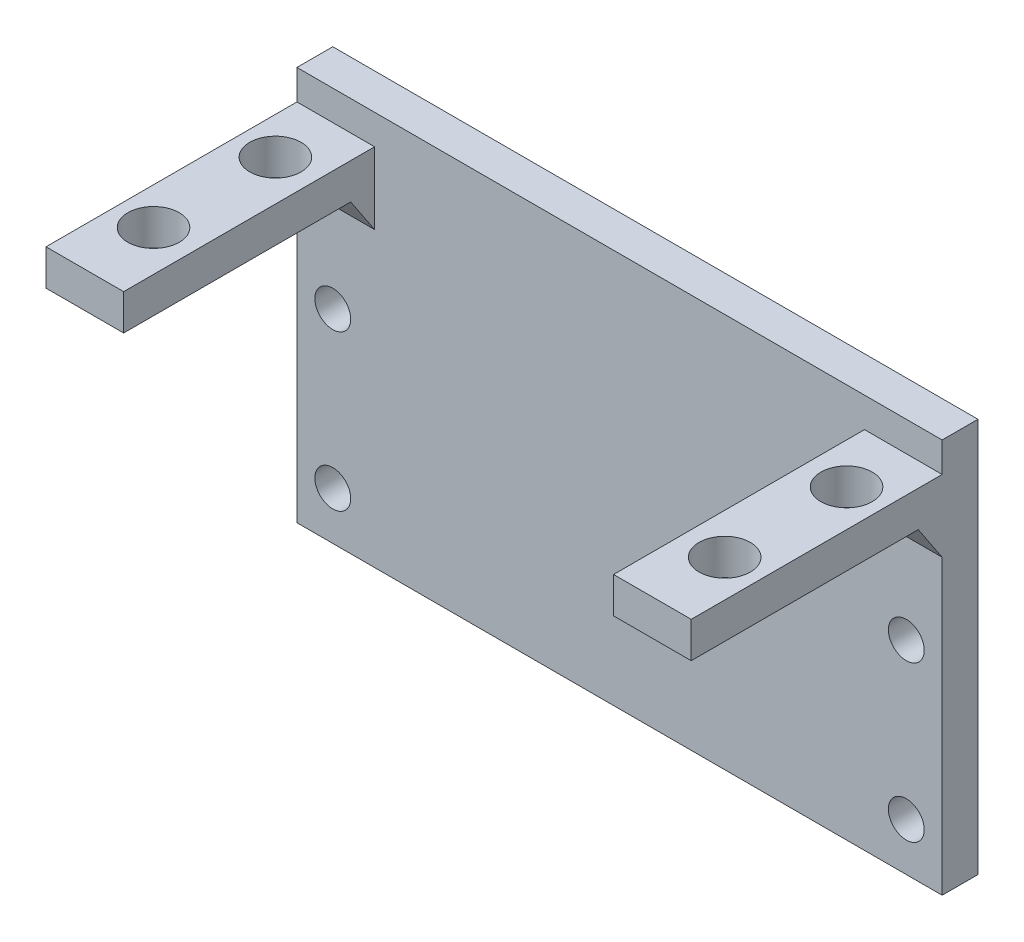
from build123d import *

# Parameters (mm, degrees)
SKETCH1_W           = 54
SKETCH1_H           = 33
BOSS_EXTRUDE1_DEPTH = 3
SKETCH3_W           = 6.5
SKETCH3_H           = 3
BOSS_EXTRUDE2_DEPTH = 21
SKETCH5_R           = 2.15
CUT_EXTRUDE1_DEPTH  = 3
SKETCH6_R           = 1.5
CUT_EXTRUDE2_DEPTH  = 10
BOSS_EXTRUDE3_DEPTH = 6.5
BOSS_EXTRUDE4_DEPTH = 6.5


with BuildPart() as part:
    # Sketch1 → Boss-Extrude1 (new body)
    with BuildSketch(Plane.XY):
        with Locations((7.441119081, -7.107474474)):
            Rectangle(SKETCH1_W, SKETCH1_H)
    extrude(amount=BOSS_EXTRUDE1_DEPTH)

    # Sketch3 → Boss-Extrude2 (add)
    with BuildSketch(Plane.XY.offset(3)):
        with Locations((31.191119081, 5.392525526)):
            Rectangle(SKETCH3_W, SKETCH3_H)
        with Locations((-16.308880919, 5.392525526)):
            Rectangle(SKETCH3_W, SKETCH3_H)
    extrude(amount=BOSS_EXTRUDE2_DEPTH)

    # Sketch5 → Cut-Extrude1 (cut)
    with BuildSketch(Plane(origin=(0, 6.892525526, 0), x_dir=(1, 0, 0), z_dir=(0, 1, 0))):
        with Locations(Location((31.341119081, -18.1, 0), (0, 0, 270))):
            Circle(SKETCH5_R)
        with Locations(Location((31.341119081, -7.9, 0), (0, 0, 270))):
            Circle(SKETCH5_R)
        with Locations(Location((-16.458880919, -18.1, 0), (0, 0, 270))):
            Circle(SKETCH5_R)
        with Locations(Location((-16.458880919, -7.9, 0), (0, 0, 270))):
            Circle(SKETCH5_R)
    extrude(amount=-CUT_EXTRUDE1_DEPTH, mode=Mode.SUBTRACT)

    # Sketch6 → Cut-Extrude2 (cut)
    with BuildSketch(Plane.XY.offset(3)):
        with Locations((31.441119081, -19.607474474)):
            Circle(SKETCH6_R)
        with Locations((-16.558880919, -19.607474474)):
            Circle(SKETCH6_R)
        with Locations((-16.558880919, -6.607474474)):
            Circle(SKETCH6_R)
        with Locations((31.441119081, -6.607474474)):
            Circle(SKETCH6_R)
    extrude(amount=-CUT_EXTRUDE2_DEPTH, mode=Mode.SUBTRACT)

    # Sketch7 → Boss-Extrude3 (add)
    with BuildSketch(Plane(origin=(34.441119081, 0, 0), x_dir=(0, 0, -1), z_dir=(1, 0, 0))):
        Polygon((-5, 3.892525526), (-3, 3.892525526), (-3, 0.892525526), align=None)
    extrude(amount=-BOSS_EXTRUDE3_DEPTH)

    # Sketch8 → Boss-Extrude4 (add)
    with BuildSketch(Plane.ZY.offset(19.558880919)):
        Polygon((5, 3.892525526), (3, 3.892525526), (3, 0.892525526), align=None)
    extrude(amount=-BOSS_EXTRUDE4_DEPTH)


solid = part.part
